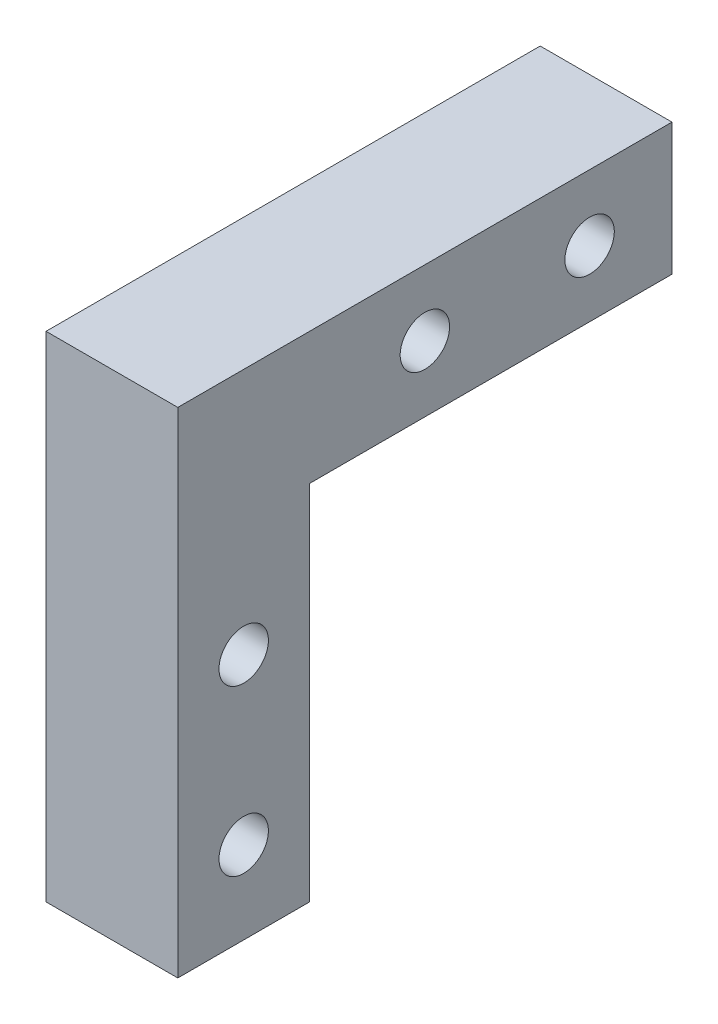
from build123d import *

# Parameters (mm, degrees)
BOSS_EXTRUDE1_DEPTH = 8
SKETCH2_R           = 3
CUT_EXTRUDE1_DEPTH  = 65.249513617


with BuildPart() as part:
    # Sketch1 → Boss-Extrude1 (new, symmetric)
    with BuildSketch(Plane(origin=(0, 0, 0), x_dir=(0, 0, -1), z_dir=(1, 0, 0))):
        Polygon((0, 0), (0, -44), (-16, -44), (-16, 16), (44, 16), (44, 0), align=None)
    extrude(amount=BOSS_EXTRUDE1_DEPTH, both=True)

    # Sketch2 → Cut-Extrude1 (cut, through all)
    with BuildSketch(Plane(origin=(8, 0, 0), x_dir=(0, 0, -1), z_dir=(1, 0, 0))):
        with Locations((-8, -34)):
            Circle(SKETCH2_R)
        with Locations((-8, -14)):
            Circle(SKETCH2_R)
        with Locations((14, 8)):
            Circle(SKETCH2_R)
        with Locations((34, 8)):
            Circle(SKETCH2_R)
    extrude(amount=-CUT_EXTRUDE1_DEPTH, mode=Mode.SUBTRACT)


solid = part.part
